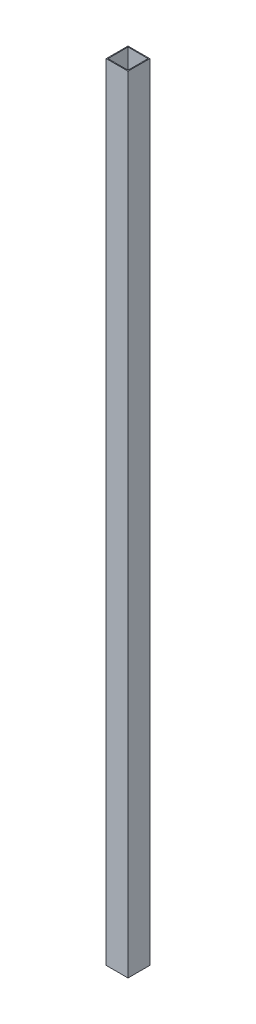
from build123d import *

# Parameters (mm, degrees)
SKETCH1_W           = 50
SKETCH1_H           = 50
SKETCH1_W_2         = 46
SKETCH1_H_2         = 46
BOSS_EXTRUDE1_DEPTH = 1800


with BuildPart() as part:
    # Sketch1 → Boss-Extrude1 (new body)
    with BuildSketch(Plane(origin=(0, 0, 0), x_dir=(1, 0, 0), z_dir=(0, 1, 0))):
        Rectangle(SKETCH1_W, SKETCH1_H)
        Rectangle(SKETCH1_W_2, SKETCH1_H_2, mode=Mode.SUBTRACT)
    extrude(amount=BOSS_EXTRUDE1_DEPTH)


solid = part.part
